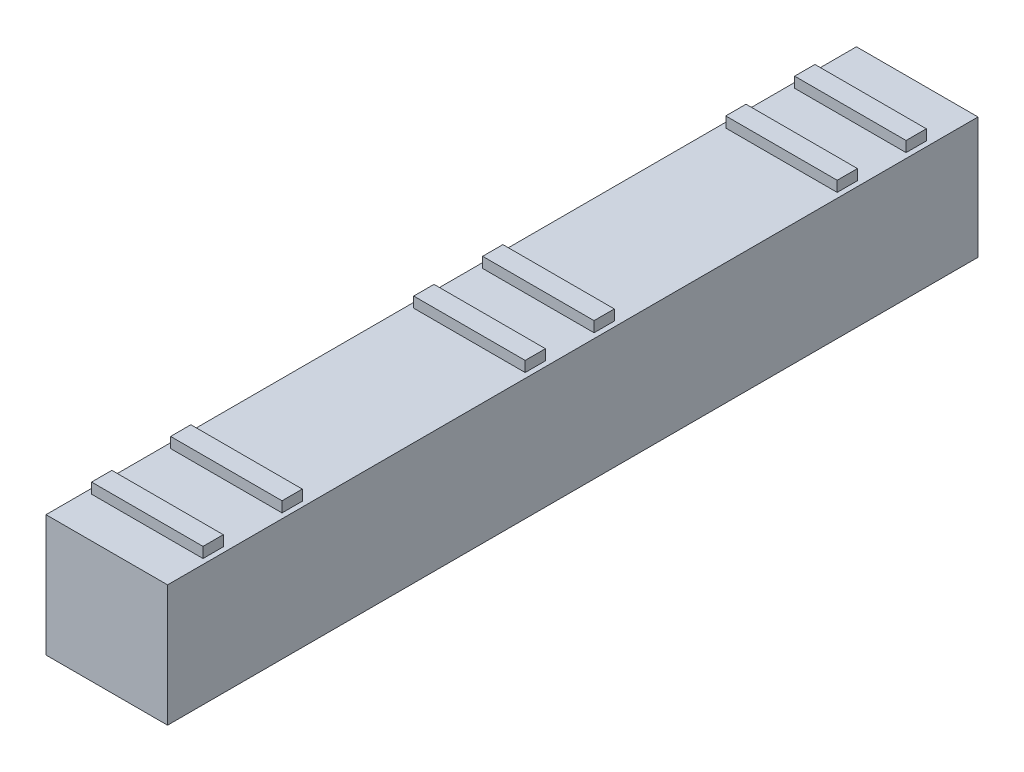
from build123d import *

# Parameters (mm, degrees)
SKETCH1_W           = 30
SKETCH1_H           = 200
BOSS_EXTRUDE1_DEPTH = 30
SKETCH3_W           = 27.5
SKETCH3_H           = 5
BOSS_EXTRUDE2_DEPTH = 2.6


with BuildPart() as part:
    # Sketch1 → Boss-Extrude1 (new body)
    with BuildSketch(Plane(origin=(0, 0, 0), x_dir=(1, 0, 0), z_dir=(0, 1, 0))):
        Rectangle(SKETCH1_W, SKETCH1_H)
    extrude(amount=BOSS_EXTRUDE1_DEPTH)

    # Sketch3 → Boss-Extrude2 (add)
    with BuildSketch(Plane(origin=(0, 30, 0), x_dir=(1, 0, 0), z_dir=(0, 1, 0))):
        with Locations((0, -87.5)):
            Rectangle(SKETCH3_W, SKETCH3_H)
    boss_extrude2 = extrude(amount=BOSS_EXTRUDE2_DEPTH)

    # Sketch-Pattern1: Boss-Extrude2 at 5 more places
    with Locations((0, 0, -19.5), (0, 0, -79.5), (0, 0, -96.5), (0, 0, -156.5), (0, 0, -173.5)):
        add(boss_extrude2)


solid = part.part
